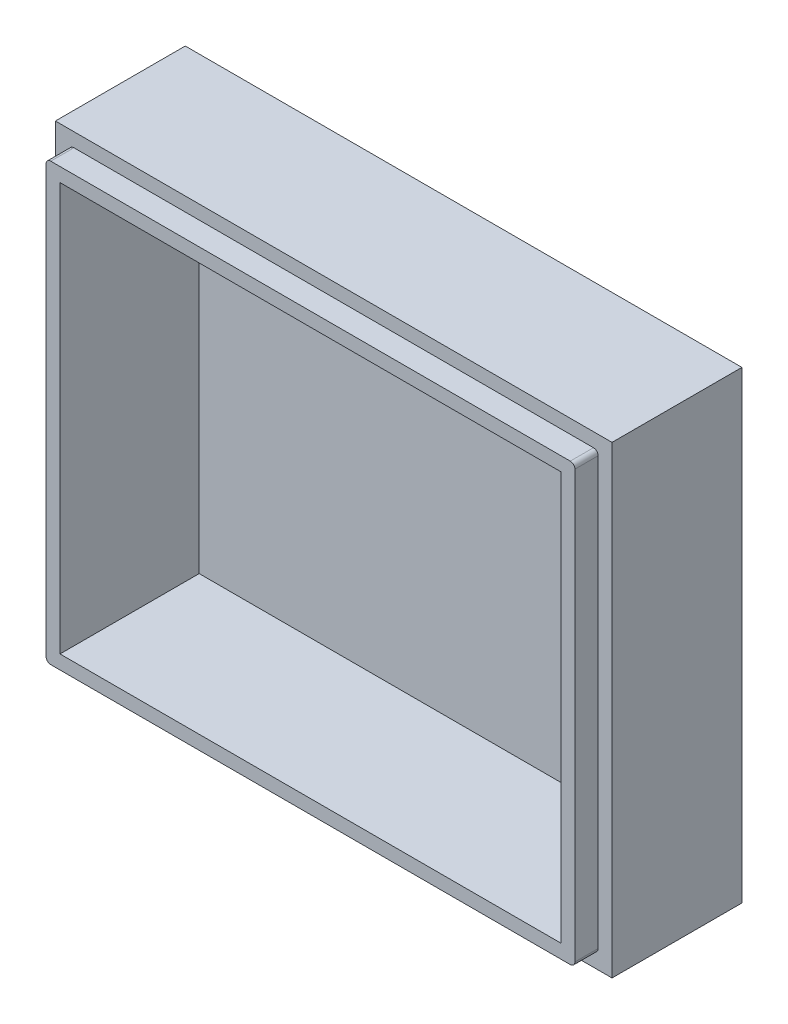
from build123d import *

# Parameters (mm, degrees)
CROQUIS1_W              = 120
CROQUIS1_H              = 100
SALIENTE_EXTRUIR1_DEPTH = 3
CROQUIS3_W              = 120
CROQUIS3_H              = 100
CROQUIS3_W_2            = 114
CROQUIS3_H_2            = 94
SALIENTE_EXTRUIR2_DEPTH = 25
CROQUIS4_W              = 114
CROQUIS4_H              = 94
CROQUIS4_W_2            = 108
CROQUIS4_H_2            = 88
SALIENTE_EXTRUIR3_DEPTH = 30
REDONDEO1_R             = 1


with BuildPart() as part:
    # Croquis1 → Saliente-Extruir1 (new body)
    with BuildSketch(Plane.XY):
        with Locations((60, 50)):
            Rectangle(CROQUIS1_W, CROQUIS1_H)
    extrude(amount=SALIENTE_EXTRUIR1_DEPTH)

    # Croquis3 → Saliente-Extruir2 (add)
    with BuildSketch(Plane.XY.offset(3)):
        with Locations((60, 50)):
            Rectangle(CROQUIS3_W, CROQUIS3_H)
        with Locations((60, 50)):
            Rectangle(CROQUIS3_W_2, CROQUIS3_H_2, mode=Mode.SUBTRACT)
    extrude(amount=SALIENTE_EXTRUIR2_DEPTH)

    # Croquis4 → Saliente-Extruir3 (add)
    with BuildSketch(Plane.XY.offset(3)):
        with Locations((60, 50)):
            Rectangle(CROQUIS4_W, CROQUIS4_H)
        with Locations((60, 50)):
            Rectangle(CROQUIS4_W_2, CROQUIS4_H_2, mode=Mode.SUBTRACT)
    extrude(amount=SALIENTE_EXTRUIR3_DEPTH)

    # Redondeo1
    redondeo1_edges = [part.edges().sort_by_distance(p)[0] for p in [
        (3, 97, 30.5),
        (3, 3, 30.5),
        (117, 3, 30.5),
        (117, 97, 30.5),
    ]]
    fillet(redondeo1_edges, radius=REDONDEO1_R)


solid = part.part
